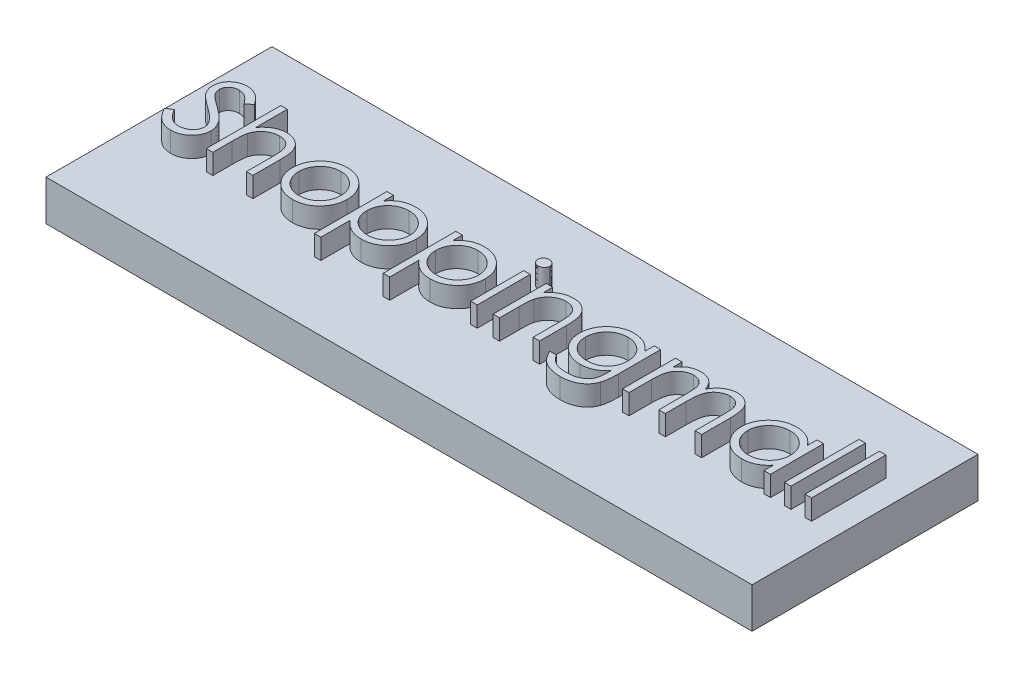
from build123d import *

# Parameters (mm, degrees)
SKETCH1_W              = 175
SKETCH1_H              = 56
BOSS_EXTRUDE1_DEPTH    = 10
BOSS_EXTRUDE2_DEPTH    = 5
BOSS_EXTRUDE2_2_DEPTH  = 5
BOSS_EXTRUDE2_3_DEPTH  = 5
BOSS_EXTRUDE2_4_DEPTH  = 5
BOSS_EXTRUDE2_5_DEPTH  = 5
BOSS_EXTRUDE2_6_DEPTH  = 5
SKETCH2_W              = 1.615384616
SKETCH2_H              = 13.153846154
BOSS_EXTRUDE2_7_DEPTH  = 5
BOSS_EXTRUDE2_8_DEPTH  = 5
BOSS_EXTRUDE2_9_DEPTH  = 5
BOSS_EXTRUDE2_10_DEPTH = 5
BOSS_EXTRUDE2_11_DEPTH = 5
SKETCH2_H_2            = 18.461538462
BOSS_EXTRUDE2_12_DEPTH = 5
BOSS_EXTRUDE2_13_DEPTH = 5


with BuildPart() as part:
    # Sketch1 → Boss-Extrude1 (new body)
    with BuildSketch(Plane(origin=(0, 0, 0), x_dir=(1, 0, 0), z_dir=(0, 1, 0))):
        Rectangle(SKETCH1_W, SKETCH1_H)
    extrude(amount=BOSS_EXTRUDE1_DEPTH)


with BuildPart() as body_2:
    # Sketch2 → Boss-Extrude2 (new body)
    with BuildSketch(Plane(origin=(0, 10, 0), x_dir=(1, 0, 0), z_dir=(0, 1, 0))):
        with BuildLine():
            Line((-82.615384615, -3.527644231), (-81.09375, -2.615384615))
            add(Edge.make_bspline(
                [(-81.09375, -2.615384615), (-80.952227637, -2.852287167), (-80.681076251, -3.306183312), (-80.228754975, -3.919510377), (-79.760071432, -4.440801469), (-79.27155486, -4.867024022), (-78.766187126, -5.202589726), (-78.240669136, -5.440201203), (-77.696771824, -5.588397648), (-77.326620742, -5.606398093), (-77.141826923, -5.615384615)],
                knots=[0, 0, 0, 0, 1.272034388, 2.437168799, 3.508375237, 4.49857839, 5.41946034, 6.295179144, 7.148887113, 8, 8, 8, 8], degree=3))
            add(Edge.make_bspline(
                [(-77.141826923, -5.615384615), (-76.984008783, -5.610989157), (-76.67113395, -5.60227515), (-76.21052813, -5.518545311), (-75.763193146, -5.389911505), (-75.338348724, -5.205689571), (-74.941856992, -4.98280593), (-74.594165416, -4.713597017), (-74.293585405, -4.412193674), (-74.047709959, -4.075940021), (-73.859069777, -3.714308971), (-73.714081997, -3.343118365), (-73.633621618, -2.956537156), (-73.621501172, -2.696254776), (-73.615384615, -2.564903846)],
                knots=[0, 0, 0, 0, 1.095163259, 2.171163733, 3.241058638, 4.321873601, 5.38011039, 6.391990106, 7.366004449, 8.327778327, 9.272591725, 10.192022065, 11.087607919, 12, 12, 12, 12], degree=3))
            add(Edge.make_bspline(
                [(-73.615384615, -2.564903846), (-73.622966785, -2.415036619), (-73.638380227, -2.110378446), (-73.76865641, -1.660894517), (-73.973595394, -1.216075585), (-74.162660419, -0.940926219), (-74.260817308, -0.798076923)],
                knots=[0, 0, 0, 0, 0.938893495, 1.908633276, 2.914225137, 4, 4, 4, 4], degree=3))
            add(Edge.make_bspline(
                [(-74.260817308, -0.798076923), (-74.341409038, -0.694978973), (-74.510601294, -0.478537723), (-74.801468502, -0.156362227), (-75.142779947, 0.175961071), (-75.522855372, 0.531121935), (-75.955539829, 0.892602032), (-76.427281332, 1.27763889), (-76.950124035, 1.671589858), (-77.31680716, 1.935791624), (-77.506009615, 2.072115385)],
                knots=[0, 0, 0, 0, 0.722233717, 1.516239348, 2.393582979, 3.351407094, 4.387010283, 5.505090956, 6.712668013, 8, 8, 8, 8], degree=3))
            add(Edge.make_bspline(
                [(-77.506009615, 2.072115385), (-77.695390167, 2.207005264), (-78.057471361, 2.464904441), (-78.563829784, 2.847657902), (-79.01662988, 3.197597802), (-79.413859108, 3.518018436), (-79.755342749, 3.80896326), (-80.04377172, 4.067638376), (-80.271798585, 4.301039546), (-80.398598714, 4.452452161), (-80.455528846, 4.520432692)],
                knots=[0, 0, 0, 0, 1.452282411, 2.77665338, 3.964542531, 5.026858415, 5.96415736, 6.766646006, 7.446254459, 8, 8, 8, 8], degree=3))
            add(Edge.make_bspline(
                [(-80.455528846, 4.520432692), (-80.535101936, 4.626380882), (-80.691593096, 4.834742216), (-80.898161124, 5.160412913), (-81.073733962, 5.493789706), (-81.211368813, 5.835768438), (-81.327269367, 6.181548072), (-81.405224439, 6.535640193), (-81.454037337, 6.896455945), (-81.459036125, 7.139268234), (-81.461538462, 7.260817308)],
                knots=[0, 0, 0, 0, 1.068054152, 2.10047183, 3.106115577, 4.101338837, 5.06977816, 6.043150881, 7.020423561, 8, 8, 8, 8], degree=3))
            add(Edge.make_bspline(
                [(-81.461538462, 7.260817308), (-81.454825958, 7.451256148), (-81.441544426, 7.828063333), (-81.329221766, 8.378507604), (-81.151932599, 8.90403775), (-80.90355889, 9.399450895), (-80.583378218, 9.851847368), (-80.212856064, 10.266431015), (-79.771539849, 10.614955152), (-79.287326358, 10.91947431), (-78.757322158, 11.157824782), (-78.20194037, 11.337624109), (-77.620298285, 11.439500291), (-77.226339307, 11.454120225), (-77.026442308, 11.461538462)],
                knots=[0, 0, 0, 0, 1.005424448, 1.989358655, 2.955360095, 3.929531133, 4.905563448, 5.876582895, 6.856512386, 7.866279853, 8.892233794, 9.918561126, 10.94386622, 12, 12, 12, 12], degree=3))
            add(Edge.make_bspline(
                [(-77.026442308, 11.461538462), (-76.814329792, 11.454222482), (-76.392505697, 11.439673333), (-75.772024017, 11.313171744), (-75.174626047, 11.103854003), (-74.694060685, 10.866312334), (-74.31794934, 10.629065053), (-74.031118144, 10.412963099), (-73.740456968, 10.164176826), (-73.443621258, 9.882043561), (-73.145640723, 9.563974555), (-72.842091541, 9.212148155), (-72.532263872, 8.828714439), (-72.33294802, 8.554988435), (-72.230769231, 8.414663462)],
                knots=[0, 0, 0, 0, 1.286793592, 2.559021753, 3.825965368, 5.121522368, 5.803751409, 6.523245864, 7.299691795, 8.125521123, 9.008227632, 9.944561021, 10.946284179, 12, 12, 12, 12], degree=3))
            Line((-72.230769231, 8.414663462), (-73.691105769, 7.307692308))
            add(Edge.make_bspline(
                [(-73.691105769, 7.307692308), (-73.779284851, 7.421291287), (-73.949097144, 7.640056361), (-74.206905934, 7.946423127), (-74.44989898, 8.226279307), (-74.689301036, 8.469357108), (-74.912468284, 8.68896808), (-75.129070215, 8.876989686), (-75.335989736, 9.035264177), (-75.596819562, 9.204173914), (-75.924510685, 9.371607361), (-76.335859728, 9.513288334), (-76.765732, 9.598428652), (-77.058512962, 9.609685788), (-77.206730769, 9.615384615)],
                knots=[0, 0, 0, 0, 1.181633172, 2.275549214, 3.290209073, 4.226197932, 5.078386478, 5.862611352, 6.581680152, 7.217281963, 8.414376989, 9.595101626, 10.782541182, 12, 12, 12, 12], degree=3))
            add(Edge.make_bspline(
                [(-77.206730769, 9.615384615), (-77.392678599, 9.609153016), (-77.751261471, 9.597135963), (-78.260354114, 9.465890324), (-78.718551443, 9.259240757), (-79.112250349, 8.969620869), (-79.440040517, 8.626484335), (-79.677154304, 8.231621652), (-79.819869436, 7.795597867), (-79.837284589, 7.491440778), (-79.846153846, 7.336538462)],
                knots=[0, 0, 0, 0, 1.14458467, 2.207223713, 3.21896685, 4.227309161, 5.202851033, 6.127160689, 7.046193047, 8, 8, 8, 8], degree=3))
            add(Edge.make_bspline(
                [(-79.846153846, 7.336538462), (-79.844132052, 7.240102286), (-79.840085158, 7.047072243), (-79.783643341, 6.761893502), (-79.711132506, 6.477435185), (-79.596227543, 6.194976187), (-79.437594553, 5.909576627), (-79.22928222, 5.616321976), (-78.966928044, 5.312627475), (-78.765960552, 5.115103838), (-78.659855769, 5.010817308)],
                knots=[0, 0, 0, 0, 0.858281714, 1.717966888, 2.583508476, 3.4729293, 4.427298488, 5.488583878, 6.674047936, 8, 8, 8, 8], degree=3))
            add(Edge.make_bspline(
                [(-78.659855769, 5.010817308), (-78.620454425, 4.975655461), (-78.526845852, 4.892118961), (-78.355712519, 4.75535866), (-78.129720985, 4.586658688), (-77.854772522, 4.377923918), (-77.525797519, 4.135790684), (-77.142759802, 3.863354965), (-76.709929061, 3.551772604), (-76.40278778, 3.333933824), (-76.240384615, 3.21875)],
                knots=[0, 0, 0, 0, 0.420754252, 0.999615792, 1.744751191, 2.668019286, 3.750313428, 4.999500688, 6.413464383, 8, 8, 8, 8], degree=3))
            add(Edge.make_bspline(
                [(-76.240384615, 3.21875), (-76.04502849, 3.076594437), (-75.666748428, 2.80132989), (-75.128509446, 2.387763536), (-74.640484147, 1.983289298), (-74.2009591, 1.590490175), (-73.805592143, 1.212345697), (-73.458769579, 0.844306484), (-73.156957509, 0.489009253), (-72.832035814, 0.03349315), (-72.500024171, -0.525952427), (-72.214896418, -1.211383368), (-72.035110631, -1.89947873), (-72.01159998, -2.361959604), (-72, -2.590144231)],
                knots=[0, 0, 0, 0, 1.163667725, 2.253281268, 3.268753668, 4.215851969, 5.092017293, 5.902905408, 6.650798638, 7.335211899, 8.59617414, 9.77448103, 10.901945474, 12, 12, 12, 12], degree=3))
            add(Edge.make_bspline(
                [(-72, -2.590144231), (-72.003379567, -2.75151868), (-72.010073074, -3.071133795), (-72.087014916, -3.540445619), (-72.199744622, -3.99626152), (-72.369650397, -4.432947242), (-72.577026639, -4.858491735), (-72.840167343, -5.261732366), (-73.145178293, -5.651593844), (-73.495066227, -6.017680371), (-73.877930867, -6.353746522), (-74.282589868, -6.652695981), (-74.709705558, -6.901961644), (-75.156960901, -7.105365975), (-75.624458632, -7.264452637), (-76.112041521, -7.379718821), (-76.620513293, -7.450462477), (-76.966115769, -7.45780525), (-77.141826923, -7.461538462)],
                knots=[0, 0, 0, 0, 0.983748083, 1.948392443, 2.894712957, 3.844097841, 4.80183111, 5.778335162, 6.776009319, 7.81870978, 8.863265674, 9.881300176, 10.883814829, 11.87499822, 12.874611388, 13.892143829, 14.928324115, 16, 16, 16, 16], degree=3))
            add(Edge.make_bspline(
                [(-77.141826923, -7.461538462), (-77.277780116, -7.458909528), (-77.54797431, -7.453684768), (-77.947623074, -7.407495326), (-78.339198104, -7.342144508), (-78.71778584, -7.238392148), (-79.088263957, -7.112510552), (-79.449021164, -6.957513413), (-79.800232298, -6.771767805), (-80.143865581, -6.559393393), (-80.47904705, -6.312239278), (-80.802632885, -6.024375582), (-81.125240125, -5.703741556), (-81.437346735, -5.341630088), (-81.745265763, -4.943891376), (-82.042926155, -4.506804147), (-82.336489274, -4.032749185), (-82.520683109, -3.699157315), (-82.615384615, -3.527644231)],
                knots=[0, 0, 0, 0, 0.915332311, 1.819136955, 2.706846663, 3.586547465, 4.459518054, 5.340707479, 6.227863349, 7.133153174, 8.059268498, 9.028702269, 10.047606654, 11.120612155, 12.245963614, 13.433783089, 14.680604001, 16, 16, 16, 16], degree=3))
        make_face()
    extrude(amount=BOSS_EXTRUDE2_DEPTH)


with BuildPart() as body_3:
    # Sketch2 → Boss-Extrude2 2 (new body)
    with BuildSketch(Plane(origin=(0, 10, 0), x_dir=(1, 0, 0), z_dir=(0, 1, 0))):
        with BuildLine():
            Line((-68.769230769, 11.461538462), (-67.153846154, 11.461538462))
            Line((-67.153846154, 11.461538462), (-67.153846154, 3.669471154))
            add(Edge.make_bspline(
                [(-67.153846154, 3.669471154), (-66.980442888, 3.886211633), (-66.642817845, 4.308216453), (-66.074552102, 4.858816863), (-65.490987617, 5.336066915), (-64.871968595, 5.715972123), (-64.228851633, 6.016091489), (-63.558924319, 6.228942242), (-62.862062181, 6.359833596), (-62.388789981, 6.376282602), (-62.149038462, 6.384615385)],
                knots=[0, 0, 0, 0, 1.125788106, 2.19196713, 3.20547328, 4.180437432, 5.132270164, 6.079753143, 7.027236121, 8, 8, 8, 8], degree=3))
            add(Edge.make_bspline(
                [(-62.149038462, 6.384615385), (-61.905625013, 6.375638886), (-61.429206179, 6.358069713), (-60.735530085, 6.219143754), (-60.0877313, 5.981762644), (-59.487735537, 5.656903658), (-58.948637094, 5.252300546), (-58.471124021, 4.785167001), (-58.081085628, 4.243758279), (-57.81571874, 3.743583259), (-57.6430555, 3.29852681), (-57.533760393, 2.916739032), (-57.44109023, 2.49131205), (-57.360348732, 2.022464855), (-57.306536027, 1.507946831), (-57.263312277, 0.950079237), (-57.232576227, 0.348894058), (-57.231385118, -0.067267225), (-57.230769231, -0.282451923)],
                knots=[0, 0, 0, 0, 1.235656852, 2.418478516, 3.575258207, 4.727955599, 5.870717718, 6.98870536, 8.107142894, 9.245821548, 9.854588956, 10.528768408, 11.260415777, 12.065282286, 12.943670737, 13.886611085, 14.907229059, 16, 16, 16, 16], degree=3))
            Line((-57.230769231, -0.282451923), (-57.230769231, -7))
            Line((-57.230769231, -7), (-58.846153846, -7))
            Line((-58.846153846, -7), (-58.846153846, -0.8125))
            add(Edge.make_bspline(
                [(-58.846153846, -0.8125), (-58.847132548, -0.633411985), (-58.849004638, -0.290847092), (-58.855193268, 0.19960718), (-58.869008089, 0.644444443), (-58.891332337, 1.042239052), (-58.91481106, 1.393545584), (-58.947125263, 1.697853864), (-58.984720752, 1.955581851), (-59.018503057, 2.110714227), (-59.033653846, 2.180288462)],
                knots=[0, 0, 0, 0, 1.430932559, 2.737130458, 3.918967929, 4.986496826, 5.920444988, 6.731744033, 7.431208747, 8, 8, 8, 8], degree=3))
            add(Edge.make_bspline(
                [(-59.033653846, 2.180288462), (-59.092407107, 2.384430389), (-59.205359908, 2.776892055), (-59.467892362, 3.310013021), (-59.795795847, 3.764563117), (-60.196153193, 4.134408027), (-60.661881922, 4.424524515), (-61.196018881, 4.625444538), (-61.793536947, 4.750147108), (-62.214487373, 4.762692097), (-62.433894231, 4.769230769)],
                knots=[0, 0, 0, 0, 1.090059168, 2.095632401, 3.037101401, 3.955032261, 4.878929692, 5.839099886, 6.873700383, 8, 8, 8, 8], degree=3))
            add(Edge.make_bspline(
                [(-62.433894231, 4.769230769), (-62.563842779, 4.766783662), (-62.821007597, 4.761940901), (-63.202343593, 4.713320852), (-63.572264491, 4.633870299), (-63.934332834, 4.526361243), (-64.280874994, 4.380069912), (-64.621992094, 4.210714653), (-64.948019454, 4.003415056), (-65.264746512, 3.770825395), (-65.559522398, 3.513323773), (-65.833776134, 3.241539433), (-66.078259027, 2.952125331), (-66.299754637, 2.649724735), (-66.490957249, 2.330189797), (-66.657858814, 1.996601873), (-66.799470967, 1.648522267), (-66.869839099, 1.406936236), (-66.905048077, 1.286057692)],
                knots=[0, 0, 0, 0, 1.024319606, 2.027102035, 3.025350316, 4.005802111, 5.00026367, 5.987881639, 7.005602596, 8.042517216, 9.083927026, 10.089214625, 11.084353441, 12.06828073, 13.041928858, 14.016821737, 15.00770877, 16, 16, 16, 16], degree=3))
            add(Edge.make_bspline(
                [(-66.905048077, 1.286057692), (-66.925307988, 1.198521373), (-66.969456829, 1.00776896), (-67.017361686, 0.693158151), (-67.060241783, 0.327571095), (-67.096491468, -0.088437706), (-67.118724483, -0.556392667), (-67.14268115, -1.073100456), (-67.151598936, -1.641797706), (-67.153074694, -2.037260316), (-67.153846154, -2.243990385)],
                knots=[0, 0, 0, 0, 0.607992626, 1.324890765, 2.152360218, 3.099583803, 4.150613268, 5.323148443, 6.60066238, 8, 8, 8, 8], degree=3))
            Line((-67.153846154, -2.243990385), (-67.153846154, -7))
            Line((-67.153846154, -7), (-68.769230769, -7))
            Line((-68.769230769, -7), (-68.769230769, 11.461538462))
        make_face()
    extrude(amount=BOSS_EXTRUDE2_2_DEPTH)


with BuildPart() as body_4:
    # Sketch2 → Boss-Extrude2 3 (new body)
    with BuildSketch(Plane(origin=(0, 10, 0), x_dir=(1, 0, 0), z_dir=(0, 1, 0))):
        with BuildLine():
            add(Edge.make_bspline(
                [(-47.185096154, 6.384615385), (-46.938283894, 6.379359944), (-46.454345369, 6.369055311), (-45.745619099, 6.258921202), (-45.069101257, 6.090506185), (-44.42220084, 5.857681008), (-43.813202749, 5.545602406), (-43.233236351, 5.173211766), (-42.683891734, 4.732044141), (-42.35463044, 4.390774076), (-42.1875, 4.217548077)],
                knots=[0, 0, 0, 0, 1.054011418, 2.066658804, 3.057071809, 4.030435133, 4.997543892, 5.974964718, 6.972108034, 8, 8, 8, 8], degree=3))
            add(Edge.make_bspline(
                [(-42.1875, 4.217548077), (-42.043592808, 4.05187615), (-41.758563424, 3.723738504), (-41.393082584, 3.191681066), (-41.078228846, 2.640674835), (-40.825905047, 2.063402869), (-40.626953496, 1.46490456), (-40.485701344, 0.843122788), (-40.401682822, 0.199430717), (-40.390353277, -0.237731879), (-40.384615385, -0.459134615)],
                knots=[0, 0, 0, 0, 1.025258237, 2.030674902, 3.01204498, 3.988269485, 4.97094183, 5.956517959, 6.965070386, 8, 8, 8, 8], degree=3))
            add(Edge.make_bspline(
                [(-40.384615385, -0.459134615), (-40.389662262, -0.681820626), (-40.399635128, -1.121858569), (-40.493973726, -1.769958165), (-40.640705025, -2.398388681), (-40.850697336, -3.004519106), (-41.119967612, -3.590202219), (-41.448548291, -4.152879901), (-41.838745179, -4.6936623), (-42.281051448, -5.207957469), (-42.769889668, -5.681955145), (-43.300201288, -6.095071959), (-43.86156489, -6.449011228), (-44.461444993, -6.734112794), (-45.094363497, -6.958905538), (-45.761685561, -7.116791337), (-46.462374494, -7.212251425), (-46.940800204, -7.224509802), (-47.185096154, -7.230769231)],
                knots=[0, 0, 0, 0, 0.998656419, 1.973391657, 2.932242238, 3.890759089, 4.846373663, 5.82037756, 6.809684879, 7.83454468, 8.860553229, 9.859544525, 10.845671541, 11.83227036, 12.833544569, 13.85385346, 14.904124723, 16, 16, 16, 16], degree=3))
            add(Edge.make_bspline(
                [(-47.185096154, -7.230769231), (-47.430588997, -7.224488793), (-47.911399133, -7.212188239), (-48.614561326, -7.117162213), (-49.283079366, -6.958978303), (-49.916826444, -6.733374054), (-50.519285657, -6.449002115), (-51.083901927, -6.096141997), (-51.614644349, -5.681832628), (-52.103585984, -5.207990666), (-52.545864525, -4.693653747), (-52.936068568, -4.152882121), (-53.264647388, -3.59020164), (-53.533918151, -3.004519261), (-53.743910332, -2.39838864), (-53.890641666, -1.769958176), (-53.984980255, -1.121858566), (-53.994953122, -0.681820625), (-54, -0.459134615)],
                knots=[0, 0, 0, 0, 1.099876186, 2.154163076, 3.173186993, 4.173200201, 5.163417411, 6.152872554, 7.150605724, 8.17532212, 9.198891216, 10.186952605, 11.159729845, 12.11414092, 13.071450619, 14.029093627, 15.002601286, 16, 16, 16, 16], degree=3))
            add(Edge.make_bspline(
                [(-54, -0.459134615), (-53.994222975, -0.238935237), (-53.982785459, 0.19702169), (-53.898851413, 0.839503716), (-53.758150265, 1.460233146), (-53.558960226, 2.056421308), (-53.304310673, 2.631163551), (-52.993881192, 3.183531253), (-52.624672225, 3.713182798), (-52.340776474, 4.040896353), (-52.197115385, 4.206730769)],
                knots=[0, 0, 0, 0, 1.031353054, 2.041901799, 3.029428768, 4.008703097, 4.981709435, 5.96992636, 6.972712378, 8, 8, 8, 8], degree=3))
            add(Edge.make_bspline(
                [(-52.197115385, 4.206730769), (-52.030236916, 4.381459028), (-51.702041045, 4.725092894), (-51.149961874, 5.164974447), (-50.571422223, 5.545114255), (-49.955694031, 5.850991935), (-49.309325047, 6.09187574), (-48.629340371, 6.259355532), (-47.918209149, 6.368658501), (-47.431902526, 6.379243415), (-47.185096154, 6.384615385)],
                knots=[0, 0, 0, 0, 1.027980169, 2.021703884, 2.998553061, 3.971491411, 4.943284454, 5.930300938, 6.949603206, 8, 8, 8, 8], degree=3))
        make_face()
        with BuildLine():
            add(Edge.make_bspline(
                [(-47.192307692, 4.769230769), (-47.366843979, 4.764270012), (-47.711410927, 4.754476559), (-48.218597362, 4.679987906), (-48.706861011, 4.561972171), (-49.177128209, 4.394294167), (-49.627813096, 4.177785544), (-50.059347166, 3.911856835), (-50.472999714, 3.600030201), (-50.860678897, 3.242793604), (-51.216473645, 2.852558775), (-51.527503239, 2.436767215), (-51.791975214, 2.002163149), (-52.012296032, 1.548294634), (-52.176390142, 1.07056222), (-52.295565686, 0.574376117), (-52.369984066, 0.058725403), (-52.379685441, -0.291816977), (-52.384615385, -0.469951923)],
                knots=[0, 0, 0, 0, 1.021534396, 2.016698045, 2.994645724, 3.958388632, 4.93408049, 5.916473867, 6.921342795, 7.962252576, 8.998418191, 10.008913653, 10.997312074, 11.973003931, 12.956656626, 13.948281152, 14.957379055, 16, 16, 16, 16], degree=3))
            add(Edge.make_bspline(
                [(-52.384615385, -0.469951923), (-52.37635172, -0.700105206), (-52.359949892, -1.156916434), (-52.226568676, -1.82965935), (-52.003439236, -2.475508876), (-51.702133226, -3.090678861), (-51.32461553, -3.659850577), (-50.879824902, -4.167303925), (-50.372535014, -4.605402384), (-49.808793013, -4.968903875), (-49.200113664, -5.257725476), (-48.555938298, -5.462405922), (-47.884071872, -5.59546034), (-47.424913826, -5.608685066), (-47.192307692, -5.615384615)],
                knots=[0, 0, 0, 0, 1.016792936, 2.018143844, 3.017858371, 4.030088057, 5.03801393, 6.028138512, 7.003788237, 7.991172063, 8.984598303, 9.972568034, 10.972917682, 12, 12, 12, 12], degree=3))
            add(Edge.make_bspline(
                [(-47.192307692, -5.615384615), (-46.959714938, -5.608646031), (-46.500583301, -5.595344253), (-45.829650392, -5.463076037), (-45.187235679, -5.256828639), (-44.579188544, -4.969228703), (-44.015703155, -4.604021998), (-43.504764816, -4.169777773), (-43.063771959, -3.658506538), (-42.686627705, -3.089924961), (-42.380387314, -2.476462579), (-42.158302276, -1.82954015), (-42.024600406, -1.156946791), (-42.008241858, -0.700115376), (-42, -0.469951923)],
                knots=[0, 0, 0, 0, 1.02726834, 2.027799167, 3.010890988, 4.004497153, 4.992059811, 5.971914811, 6.958719428, 7.966827853, 8.981595046, 9.981490638, 10.983022906, 12, 12, 12, 12], degree=3))
            add(Edge.make_bspline(
                [(-42, -0.469951923), (-42.004928246, -0.291815912), (-42.014626281, 0.058728563), (-42.089068955, 0.574364038), (-42.208154588, 1.070606535), (-42.372580048, 1.548131124), (-42.591943548, 2.003338289), (-42.861515626, 2.435491171), (-43.171275186, 2.853999122), (-43.531363236, 3.241532132), (-43.918637751, 3.600169463), (-44.332457947, 3.911977751), (-44.763352123, 4.176616814), (-45.212727691, 4.396146051), (-45.683055182, 4.560446658), (-46.170634703, 4.680669334), (-46.675657154, 4.754161774), (-47.018989376, 4.764175645), (-47.192307692, 4.769230769)],
                knots=[0, 0, 0, 0, 1.042956736, 2.052379634, 3.044323526, 4.02829302, 5.004299113, 5.996692471, 7.007513377, 8.048758398, 9.090003419, 10.095195979, 11.07790575, 12.047570684, 13.018257071, 13.989683339, 14.985167495, 16, 16, 16, 16], degree=3))
        make_face(mode=Mode.SUBTRACT)
    extrude(amount=BOSS_EXTRUDE2_3_DEPTH)


with BuildPart() as body_5:
    # Sketch2 → Boss-Extrude2 4 (new body)
    with BuildSketch(Plane(origin=(0, 10, 0), x_dir=(1, 0, 0), z_dir=(0, 1, 0))):
        with BuildLine():
            Line((-37.153846154, 6.153846154), (-35.538461538, 6.153846154))
            Line((-35.538461538, 6.153846154), (-35.538461538, 3.719951923))
            add(Edge.make_bspline(
                [(-35.538461538, 3.719951923), (-35.366908763, 3.940774554), (-35.033530276, 4.369899146), (-34.458945051, 4.92527695), (-33.85246432, 5.393664226), (-33.198481055, 5.760774396), (-32.507159221, 6.037567143), (-31.781335874, 6.242147171), (-31.014850798, 6.362703326), (-30.490811898, 6.377214726), (-30.223557692, 6.384615385)],
                knots=[0, 0, 0, 0, 1.0828784, 2.104357462, 3.088488658, 4.04616522, 5.001424249, 5.969181776, 6.964304535, 8, 8, 8, 8], degree=3))
            add(Edge.make_bspline(
                [(-30.223557692, 6.384615385), (-29.990115162, 6.377861893), (-29.528703736, 6.364513263), (-28.849521416, 6.274137553), (-28.195476586, 6.119246564), (-27.570269452, 5.896041856), (-26.967202259, 5.620099439), (-26.395202889, 5.271840399), (-25.845361745, 4.868608561), (-25.331507059, 4.404557499), (-24.856711454, 3.902469272), (-24.446073951, 3.362354565), (-24.091875586, 2.801975549), (-23.805571204, 2.212644789), (-23.581299703, 1.599003036), (-23.421795647, 0.958571054), (-23.326870623, 0.29372336), (-23.314134586, -0.158347774), (-23.307692308, -0.387019231)],
                knots=[0, 0, 0, 0, 1.041296284, 2.058176809, 3.050446431, 4.034000596, 5.01514041, 6.003636468, 7.015969324, 8.052561599, 9.08815499, 10.094063707, 11.074456064, 12.040834395, 13.011057502, 13.983766392, 14.980127149, 16, 16, 16, 16], degree=3))
            add(Edge.make_bspline(
                [(-23.307692308, -0.387019231), (-23.313994805, -0.620516818), (-23.326424239, -1.081007755), (-23.422827126, -1.757227112), (-23.576891051, -2.407733606), (-23.798333135, -3.031445247), (-24.084489361, -3.627932597), (-24.432684243, -4.196765491), (-24.843528931, -4.737761679), (-25.313077588, -5.243576593), (-25.822492687, -5.709515917), (-26.367005491, -6.117025989), (-26.938165679, -6.459238776), (-27.53305111, -6.745093997), (-28.156754394, -6.960539515), (-28.806365536, -7.115945347), (-29.481530861, -7.211779896), (-29.940793928, -7.224390915), (-30.173076923, -7.230769231)],
                knots=[0, 0, 0, 0, 1.038740735, 2.04854663, 3.033179607, 4.009277356, 4.987731542, 5.972001279, 6.972200261, 8.005528982, 9.039189865, 10.040446548, 11.026516639, 11.997840187, 12.972163198, 13.956796175, 14.96660207, 16, 16, 16, 16], degree=3))
            add(Edge.make_bspline(
                [(-30.173076923, -7.230769231), (-30.434475865, -7.22411022), (-30.95081541, -7.21095672), (-31.705774858, -7.077656897), (-32.432341525, -6.878438371), (-33.122465766, -6.586843547), (-33.781614516, -6.215243751), (-34.406059232, -5.762105549), (-34.999116818, -5.228376621), (-35.356076141, -4.823470138), (-35.538461538, -4.616586538)],
                knots=[0, 0, 0, 0, 1.014726462, 2.004382257, 2.969841629, 3.936926163, 4.907207904, 5.903978561, 6.929055279, 8, 8, 8, 8], degree=3))
            Line((-35.538461538, -4.616586538), (-35.538461538, -11.846153846))
            Line((-35.538461538, -11.846153846), (-37.153846154, -11.846153846))
            Line((-37.153846154, -11.846153846), (-37.153846154, 6.153846154))
        make_face()
        with BuildLine():
            add(Edge.make_bspline(
                [(-30.237980769, 4.769230769), (-30.420961376, 4.765938013), (-30.781203028, 4.759455424), (-31.309231582, 4.682446544), (-31.817836639, 4.570652447), (-32.30189239, 4.401391246), (-32.766038417, 4.193625921), (-33.206699836, 3.934004149), (-33.623567326, 3.627222404), (-34.015592054, 3.279157207), (-34.369746135, 2.89563024), (-34.683269764, 2.486321507), (-34.946621619, 2.05174936), (-35.165203437, 1.595961782), (-35.33154032, 1.11538603), (-35.449598307, 0.612759107), (-35.52381155, 0.087530872), (-35.533526085, -0.270185733), (-35.538461538, -0.451923077)],
                knots=[0, 0, 0, 0, 1.05670511, 2.080379991, 3.077984906, 4.06214886, 5.038337365, 6.01289324, 7.01187578, 8.025460281, 9.038092164, 10.024533457, 11.000252242, 11.969694649, 12.940728589, 13.933144304, 14.949937299, 16, 16, 16, 16], degree=3))
            add(Edge.make_bspline(
                [(-35.538461538, -0.451923077), (-35.530279993, -0.690490513), (-35.514251652, -1.157864325), (-35.383945188, -1.840754095), (-35.171878116, -2.486962609), (-34.870873303, -3.091047942), (-34.490571492, -3.646388237), (-34.032352402, -4.143654213), (-33.50036214, -4.57972011), (-32.903445154, -4.947029414), (-32.26355991, -5.245253756), (-31.596089506, -5.458755409), (-30.910212975, -5.590269727), (-30.446490188, -5.606967653), (-30.212740385, -5.615384615)],
                knots=[0, 0, 0, 0, 1.03728447, 2.032128127, 3.01272805, 3.987917167, 4.958271349, 5.931593992, 6.91984656, 7.941419022, 8.973179163, 9.983609215, 10.983593296, 12, 12, 12, 12], degree=3))
            add(Edge.make_bspline(
                [(-30.212740385, -5.615384615), (-29.983699292, -5.607380391), (-29.5290939, -5.591493446), (-28.859709275, -5.453982767), (-28.209185992, -5.24392264), (-27.591116533, -4.93761635), (-27.010881453, -4.562238909), (-26.486919178, -4.111930167), (-26.029169337, -3.589981888), (-25.639009797, -3.008795301), (-25.324619301, -2.385607614), (-25.088406638, -1.740789044), (-24.952076833, -1.076612583), (-24.932756206, -0.629195773), (-24.923076923, -0.405048077)],
                knots=[0, 0, 0, 0, 1.00104056, 1.986885549, 2.97790532, 3.984399681, 4.995088187, 5.994304198, 6.996462723, 8.023150851, 9.048424203, 10.043036403, 11.019596776, 12, 12, 12, 12], degree=3))
            add(Edge.make_bspline(
                [(-24.923076923, -0.405048077), (-24.930558411, -0.179508133), (-24.9454631, 0.269814572), (-25.092276436, 0.932023787), (-25.312904893, 1.579447664), (-25.63463716, 2.194124777), (-26.016243689, 2.774105774), (-26.477799673, 3.286097151), (-26.995254398, 3.734403468), (-27.57479867, 4.104768433), (-28.196778001, 4.39937955), (-28.851540425, 4.614781122), (-29.535764666, 4.744246119), (-30.001849747, 4.760829294), (-30.237980769, 4.769230769)],
                knots=[0, 0, 0, 0, 0.983928682, 1.960191568, 2.949917689, 3.96440592, 4.982380491, 5.975291189, 6.965713506, 7.964880129, 8.970154049, 9.96478489, 10.968906225, 12, 12, 12, 12], degree=3))
        make_face(mode=Mode.SUBTRACT)
    extrude(amount=BOSS_EXTRUDE2_4_DEPTH)


with BuildPart() as body_6:
    # Sketch2 → Boss-Extrude2 5 (new body)
    with BuildSketch(Plane(origin=(0, 10, 0), x_dir=(1, 0, 0), z_dir=(0, 1, 0))):
        with BuildLine():
            Line((-20.076923077, 6.153846154), (-18.461538462, 6.153846154))
            Line((-18.461538462, 6.153846154), (-18.461538462, 3.719951923))
            add(Edge.make_bspline(
                [(-18.461538462, 3.719951923), (-18.289985686, 3.940774554), (-17.956607199, 4.369899146), (-17.382021974, 4.92527695), (-16.775541243, 5.393664226), (-16.121557979, 5.760774396), (-15.430236144, 6.037567143), (-14.704412797, 6.242147171), (-13.937927721, 6.362703326), (-13.413888821, 6.377214726), (-13.146634615, 6.384615385)],
                knots=[0, 0, 0, 0, 1.0828784, 2.104357462, 3.088488658, 4.04616522, 5.001424249, 5.969181776, 6.964304535, 8, 8, 8, 8], degree=3))
            add(Edge.make_bspline(
                [(-13.146634615, 6.384615385), (-12.913192085, 6.377861893), (-12.451780659, 6.364513263), (-11.772598339, 6.274137553), (-11.118553509, 6.119246564), (-10.493346375, 5.896041856), (-9.890279182, 5.620099439), (-9.318279812, 5.271840399), (-8.768438668, 4.868608561), (-8.254583982, 4.404557499), (-7.779788377, 3.902469272), (-7.369150874, 3.362354565), (-7.014952509, 2.801975549), (-6.728648127, 2.212644789), (-6.504376626, 1.599003036), (-6.34487257, 0.958571054), (-6.249947546, 0.29372336), (-6.237211509, -0.158347774), (-6.230769231, -0.387019231)],
                knots=[0, 0, 0, 0, 1.041296284, 2.058176809, 3.050446431, 4.034000596, 5.01514041, 6.003636468, 7.015969324, 8.052561599, 9.08815499, 10.094063707, 11.074456064, 12.040834395, 13.011057502, 13.983766392, 14.980127149, 16, 16, 16, 16], degree=3))
            add(Edge.make_bspline(
                [(-6.230769231, -0.387019231), (-6.237071728, -0.620516818), (-6.249501162, -1.081007755), (-6.34590405, -1.757227112), (-6.499967974, -2.407733606), (-6.721410058, -3.031445247), (-7.007566284, -3.627932597), (-7.355761166, -4.196765491), (-7.766605854, -4.737761679), (-8.236154511, -5.243576593), (-8.74556961, -5.709515917), (-9.290082414, -6.117025989), (-9.861242602, -6.459238776), (-10.456128033, -6.745093997), (-11.079831317, -6.960539515), (-11.729442459, -7.115945347), (-12.404607784, -7.211779896), (-12.863870852, -7.224390915), (-13.096153846, -7.230769231)],
                knots=[0, 0, 0, 0, 1.038740735, 2.04854663, 3.033179607, 4.009277356, 4.987731542, 5.972001279, 6.972200261, 8.005528982, 9.039189865, 10.040446548, 11.026516639, 11.997840187, 12.972163198, 13.956796175, 14.96660207, 16, 16, 16, 16], degree=3))
            add(Edge.make_bspline(
                [(-13.096153846, -7.230769231), (-13.357552788, -7.22411022), (-13.873892333, -7.21095672), (-14.628851781, -7.077656897), (-15.355418448, -6.878438371), (-16.045542689, -6.586843547), (-16.704691439, -6.215243751), (-17.329136155, -5.762105549), (-17.922193741, -5.228376621), (-18.279153064, -4.823470138), (-18.461538462, -4.616586538)],
                knots=[0, 0, 0, 0, 1.014726462, 2.004382257, 2.969841629, 3.936926163, 4.907207904, 5.903978561, 6.929055279, 8, 8, 8, 8], degree=3))
            Line((-18.461538462, -4.616586538), (-18.461538462, -11.846153846))
            Line((-18.461538462, -11.846153846), (-20.076923077, -11.846153846))
            Line((-20.076923077, -11.846153846), (-20.076923077, 6.153846154))
        make_face()
        with BuildLine():
            add(Edge.make_bspline(
                [(-13.161057692, 4.769230769), (-13.344038299, 4.765938013), (-13.704279951, 4.759455424), (-14.232308505, 4.682446544), (-14.740913563, 4.570652447), (-15.224969313, 4.401391246), (-15.68911534, 4.193625921), (-16.129776759, 3.934004149), (-16.546644249, 3.627222404), (-16.938668977, 3.279157207), (-17.292823058, 2.89563024), (-17.606346687, 2.486321507), (-17.869698542, 2.05174936), (-18.088280361, 1.595961782), (-18.254617243, 1.11538603), (-18.37267523, 0.612759107), (-18.446888473, 0.087530872), (-18.456603008, -0.270185733), (-18.461538462, -0.451923077)],
                knots=[0, 0, 0, 0, 1.05670511, 2.080379991, 3.077984906, 4.06214886, 5.038337365, 6.01289324, 7.01187578, 8.025460281, 9.038092164, 10.024533457, 11.000252242, 11.969694649, 12.940728589, 13.933144304, 14.949937299, 16, 16, 16, 16], degree=3))
            add(Edge.make_bspline(
                [(-18.461538462, -0.451923077), (-18.453356916, -0.690490513), (-18.437328575, -1.157864325), (-18.307022111, -1.840754095), (-18.094955039, -2.486962609), (-17.793950226, -3.091047942), (-17.413648415, -3.646388237), (-16.955429325, -4.143654213), (-16.423439063, -4.57972011), (-15.826522077, -4.947029414), (-15.186636834, -5.245253756), (-14.519166429, -5.458755409), (-13.833289898, -5.590269727), (-13.369567111, -5.606967653), (-13.135817308, -5.615384615)],
                knots=[0, 0, 0, 0, 1.03728447, 2.032128127, 3.01272805, 3.987917167, 4.958271349, 5.931593992, 6.91984656, 7.941419022, 8.973179163, 9.983609215, 10.983593296, 12, 12, 12, 12], degree=3))
            add(Edge.make_bspline(
                [(-13.135817308, -5.615384615), (-12.906776215, -5.607380391), (-12.452170823, -5.591493446), (-11.782786198, -5.453982767), (-11.132262915, -5.24392264), (-10.514193457, -4.93761635), (-9.933958376, -4.562238909), (-9.409996101, -4.111930167), (-8.95224626, -3.589981888), (-8.56208672, -3.008795301), (-8.247696224, -2.385607614), (-8.011483561, -1.740789044), (-7.875153756, -1.076612583), (-7.855833129, -0.629195773), (-7.846153846, -0.405048077)],
                knots=[0, 0, 0, 0, 1.00104056, 1.986885549, 2.97790532, 3.984399681, 4.995088187, 5.994304198, 6.996462723, 8.023150851, 9.048424203, 10.043036403, 11.019596776, 12, 12, 12, 12], degree=3))
            add(Edge.make_bspline(
                [(-7.846153846, -0.405048077), (-7.853635334, -0.179508133), (-7.868540023, 0.269814572), (-8.01535336, 0.932023787), (-8.235981816, 1.579447664), (-8.557714084, 2.194124777), (-8.939320612, 2.774105774), (-9.400876596, 3.286097151), (-9.918331321, 3.734403468), (-10.497875593, 4.104768433), (-11.119854924, 4.39937955), (-11.774617348, 4.614781122), (-12.458841589, 4.744246119), (-12.92492667, 4.760829294), (-13.161057692, 4.769230769)],
                knots=[0, 0, 0, 0, 0.983928682, 1.960191568, 2.949917689, 3.96440592, 4.982380491, 5.975291189, 6.965713506, 7.964880129, 8.970154049, 9.96478489, 10.968906225, 12, 12, 12, 12], degree=3))
        make_face(mode=Mode.SUBTRACT)
    extrude(amount=BOSS_EXTRUDE2_5_DEPTH)


with BuildPart() as body_7:
    # Sketch2 → Boss-Extrude2 6 (new body)
    with BuildSketch(Plane(origin=(0, 10, 0), x_dir=(1, 0, 0), z_dir=(0, 1, 0))):
        with BuildLine():
            add(Edge.make_bspline(
                [(-2.430288462, 11.692307692), (-2.330047409, 11.687657766), (-2.133756175, 11.678552316), (-1.849905085, 11.600579006), (-1.591440451, 11.468409195), (-1.362183539, 11.291085122), (-1.16545955, 11.082545127), (-1.027730183, 10.839488718), (-0.939209288, 10.576901433), (-0.928519576, 10.393738117), (-0.923076923, 10.300480769)],
                knots=[0, 0, 0, 0, 1.055194115, 2.066272739, 3.074728998, 4.095836921, 5.109056067, 6.073838105, 7.019297344, 8, 8, 8, 8], degree=3))
            add(Edge.make_bspline(
                [(-0.923076923, 10.300480769), (-0.928642316, 10.209644267), (-0.939644441, 10.030071253), (-1.027661809, 9.772036254), (-1.166633318, 9.532357082), (-1.362057392, 9.324222), (-1.591473877, 9.146995955), (-1.849896205, 9.014800155), (-2.133758511, 8.936833734), (-2.330048199, 8.927727335), (-2.430288462, 8.923076923)],
                knots=[0, 0, 0, 0, 0.96129708, 1.900370562, 2.859976407, 3.87933698, 4.906634145, 5.921202961, 6.938410037, 8, 8, 8, 8], degree=3))
            add(Edge.make_bspline(
                [(-2.430288462, 8.923076923), (-2.529382448, 8.92754977), (-2.722255946, 8.936255582), (-3.00185685, 9.016329959), (-3.258117652, 9.147041192), (-3.487821683, 9.323061572), (-3.679291248, 9.53363533), (-3.818654064, 9.771889984), (-3.906468154, 10.030108493), (-3.917497672, 10.209656777), (-3.923076923, 10.300480769)],
                knots=[0, 0, 0, 0, 1.054934014, 2.053291228, 3.073705704, 4.106921865, 5.123545215, 6.088680038, 7.033164197, 8, 8, 8, 8], degree=3))
            add(Edge.make_bspline(
                [(-3.923076923, 10.300480769), (-3.917619906, 10.393725139), (-3.906901981, 10.576862963), (-3.818588241, 10.839637418), (-3.680452086, 11.081256571), (-3.487694902, 11.292244853), (-3.258151393, 11.468364232), (-3.001848132, 11.59904928), (-2.722258249, 11.679130454), (-2.52938323, 11.687835328), (-2.430288462, 11.692307692)],
                knots=[0, 0, 0, 0, 0.98631895, 1.937192651, 2.907499808, 3.917963147, 4.944918757, 5.95915025, 6.951458133, 8, 8, 8, 8], degree=3))
        make_face()
    extrude(amount=BOSS_EXTRUDE2_6_DEPTH)


with BuildPart() as body_8:
    # Sketch2 → Boss-Extrude2 7 (new body)
    with BuildSketch(Plane(origin=(0, 10, 0), x_dir=(1, 0, 0), z_dir=(0, 1, 0))):
        with Locations((-2.423076923, -0.423076923)):
            Rectangle(SKETCH2_W, SKETCH2_H)
    extrude(amount=BOSS_EXTRUDE2_7_DEPTH)


with BuildPart() as body_9:
    # Sketch2 → Boss-Extrude2 8 (new body)
    with BuildSketch(Plane(origin=(0, 10, 0), x_dir=(1, 0, 0), z_dir=(0, 1, 0))):
        with BuildLine():
            Line((2.307692308, 6.153846154), (3.923076923, 6.153846154))
            Line((3.923076923, 6.153846154), (3.923076923, 3.78125))
            add(Edge.make_bspline(
                [(3.923076923, 3.78125), (4.095556189, 3.996441146), (4.430258223, 4.414027073), (4.987663366, 4.962875742), (5.576746282, 5.415165471), (6.193899443, 5.775699268), (6.839960638, 6.047481917), (7.51099174, 6.243763848), (8.211010229, 6.361457252), (8.687055904, 6.376835579), (8.927884615, 6.384615385)],
                knots=[0, 0, 0, 0, 1.12780773, 2.188550248, 3.19190651, 4.159438251, 5.104880172, 6.052711206, 7.014878035, 8, 8, 8, 8], degree=3))
            add(Edge.make_bspline(
                [(8.927884615, 6.384615385), (9.171299305, 6.375640094), (9.647720568, 6.358073285), (10.341379169, 6.219130302), (10.989242337, 5.981811847), (11.589000052, 5.656721199), (12.129654292, 5.252459336), (12.604467814, 4.781487887), (12.997193087, 4.239759459), (13.260493811, 3.737183227), (13.433939999, 3.291355142), (13.543134877, 2.909514713), (13.635865639, 2.484107078), (13.716257486, 2.016417763), (13.770654061, 1.503169927), (13.813557275, 0.946467511), (13.844304846, 0.34649084), (13.845524767, -0.068468958), (13.846153846, -0.282451923)],
                knots=[0, 0, 0, 0, 1.235846778, 2.418850247, 3.575807741, 4.728682307, 5.871620074, 6.994088408, 8.11269785, 9.256955736, 9.865816715, 10.540099792, 11.271859618, 12.076849838, 12.949306005, 13.892391288, 14.913166135, 16, 16, 16, 16], degree=3))
            Line((13.846153846, -0.282451923), (13.846153846, -7))
            Line((13.846153846, -7), (12.230769231, -7))
            Line((12.230769231, -7), (12.230769231, -0.8125))
            add(Edge.make_bspline(
                [(12.230769231, -0.8125), (12.22977559, -0.63341314), (12.227874923, -0.290850456), (12.221880169, 0.199618806), (12.207429735, 0.644406923), (12.187124125, 1.042450527), (12.157403397, 1.393367401), (12.126429864, 1.697872253), (12.088552841, 1.955578471), (12.054800716, 2.11071318), (12.039663462, 2.180288462)],
                knots=[0, 0, 0, 0, 1.430800155, 2.736877192, 3.918605307, 4.986035426, 5.920637409, 6.731861385, 7.431261377, 8, 8, 8, 8], degree=3))
            add(Edge.make_bspline(
                [(12.039663462, 2.180288462), (11.985017871, 2.384517413), (11.879842016, 2.777594956), (11.61995296, 3.310777341), (11.291765744, 3.764368022), (10.891148233, 4.13556259), (10.42197013, 4.424441179), (9.885533396, 4.62487866), (9.287014672, 4.75024233), (8.866049276, 4.762724724), (8.646634615, 4.769230769)],
                knots=[0, 0, 0, 0, 1.084156227, 2.086665306, 3.027808233, 3.945421172, 4.874247719, 5.839848303, 6.874090471, 8, 8, 8, 8], degree=3))
            add(Edge.make_bspline(
                [(8.646634615, 4.769230769), (8.516686528, 4.766782745), (8.259522621, 4.761938169), (7.878179909, 4.713331493), (7.508284161, 4.633830865), (7.146123086, 4.526506443), (6.798940147, 4.379100487), (6.455580935, 4.211806583), (6.12897472, 4.003272922), (5.812157249, 3.770864011), (5.517405666, 3.513313803), (5.24314564, 3.241542036), (4.998664393, 2.952124645), (4.777168349, 2.649724915), (4.585965852, 2.330189748), (4.419064256, 1.996601887), (4.277452111, 1.648522264), (4.207083979, 1.406936235), (4.171875, 1.286057692)],
                knots=[0, 0, 0, 0, 1.023777757, 2.026029729, 3.023749952, 4.003683103, 4.997618607, 5.993177895, 7.010360494, 8.046726602, 9.087585522, 10.09234134, 11.086953743, 12.070360549, 13.043493632, 14.017870808, 15.008233677, 16, 16, 16, 16], degree=3))
            add(Edge.make_bspline(
                [(4.171875, 1.286057692), (4.15161395, 1.197316648), (4.107506705, 1.004132037), (4.059867494, 0.687103594), (4.016628535, 0.32036658), (3.980438462, -0.095651051), (3.95829632, -0.562405837), (3.934153708, -1.077904431), (3.925364251, -1.644202371), (3.923860716, -2.038462505), (3.923076923, -2.243990385)],
                knots=[0, 0, 0, 0, 0.615963638, 1.340920617, 2.168419149, 3.115676021, 4.16674242, 5.331190069, 6.6087489, 8, 8, 8, 8], degree=3))
            Line((3.923076923, -2.243990385), (3.923076923, -7))
            Line((3.923076923, -7), (2.307692308, -7))
            Line((2.307692308, -7), (2.307692308, 6.153846154))
        make_face()
    extrude(amount=BOSS_EXTRUDE2_8_DEPTH)


with BuildPart() as body_10:
    # Sketch2 → Boss-Extrude2 9 (new body)
    with BuildSketch(Plane(origin=(0, 10, 0), x_dir=(1, 0, 0), z_dir=(0, 1, 0))):
        with BuildLine():
            Line((29.076923077, 6.153846154), (30.692307692, 6.153846154))
            Line((30.692307692, 6.153846154), (30.692307692, -4.284855769))
            add(Edge.make_bspline(
                [(30.692307692, -4.284855769), (30.690882902, -4.507220541), (30.688132713, -4.936438115), (30.668327718, -5.557069268), (30.626564235, -6.130323422), (30.579205303, -6.658815037), (30.511079333, -7.140094461), (30.427886587, -7.575597799), (30.334103095, -7.965742977), (30.251713405, -8.206042159), (30.212740385, -8.319711538)],
                knots=[0, 0, 0, 0, 1.307562039, 2.523909702, 3.650326591, 4.686913197, 5.643429486, 6.506965704, 7.293745905, 8, 8, 8, 8], degree=3))
            add(Edge.make_bspline(
                [(30.212740385, -8.319711538), (30.155195728, -8.467465421), (30.041826964, -8.75855544), (29.829500849, -9.17118909), (29.591726487, -9.55971338), (29.320148913, -9.92196313), (29.015996206, -10.256119822), (28.686434246, -10.569443247), (28.325044691, -10.855304679), (27.932034171, -11.108771923), (27.516462343, -11.337048202), (27.078568104, -11.534773404), (26.620820706, -11.706991457), (26.138920121, -11.835988693), (25.640421772, -11.947767256), (25.119463555, -12.020511354), (24.579089172, -12.070021939), (24.211655788, -12.07460028), (24.025240385, -12.076923077)],
                knots=[0, 0, 0, 0, 0.981931301, 1.934503488, 2.87077864, 3.801706999, 4.735015492, 5.667491629, 6.616593066, 7.585388521, 8.561939025, 9.551802639, 10.560317337, 11.588439944, 12.640189604, 13.723962949, 14.845264515, 16, 16, 16, 16], degree=3))
            add(Edge.make_bspline(
                [(24.025240385, -12.076923077), (23.75326175, -12.072518293), (23.222014403, -12.063914566), (22.44747444, -11.963675574), (21.711867309, -11.82196737), (21.02491296, -11.607482313), (20.390952462, -11.345006366), (19.814315388, -11.043660894), (19.300178264, -10.698115877), (18.836685088, -10.304684215), (18.41835691, -9.836870995), (18.024787991, -9.285562654), (17.64596029, -8.64236151), (17.423950152, -8.170284699), (17.307692308, -7.923076923)],
                knots=[0, 0, 0, 0, 1.157897085, 2.2616841, 3.32207898, 4.345638746, 5.321241055, 6.241986252, 7.112515963, 7.955008012, 8.825025602, 9.77857164, 10.836726669, 12, 12, 12, 12], degree=3))
            Line((17.307692308, -7.923076923), (18.923076923, -7.923076923))
            add(Edge.make_bspline(
                [(18.923076923, -7.923076923), (19.052996857, -8.129335713), (19.306974328, -8.532546248), (19.781909373, -9.054613907), (20.302399052, -9.500774068), (20.886008851, -9.860315192), (21.535167102, -10.131394119), (22.250264345, -10.324638501), (23.037119542, -10.440333588), (23.584927501, -10.454277386), (23.870192308, -10.461538462)],
                knots=[0, 0, 0, 0, 0.997731894, 1.950442991, 2.880492273, 3.800895997, 4.748200782, 5.754801363, 6.83083817, 8, 8, 8, 8], degree=3))
            add(Edge.make_bspline(
                [(23.870192308, -10.461538462), (24.151850601, -10.454183411), (24.694859597, -10.440003609), (25.47570561, -10.324586867), (26.188479577, -10.131352065), (26.829074894, -9.86079465), (27.389933133, -9.529335416), (27.873423373, -9.159049319), (28.265024565, -8.741547018), (28.528405536, -8.356954873), (28.692126427, -8.014316491), (28.796383645, -7.719360283), (28.881106916, -7.385831198), (28.951974652, -7.014847412), (29.010453635, -6.60587889), (29.04749703, -6.15799053), (29.074269775, -5.672200244), (29.076018192, -5.33537839), (29.076923077, -5.161057692)],
                knots=[0, 0, 0, 0, 1.570740765, 3.028230971, 4.391408896, 5.680370741, 6.894727393, 8.017376726, 9.065722033, 10.075533815, 10.603371122, 11.180248986, 11.817768598, 12.521299649, 13.286540596, 14.121245857, 15.027658897, 16, 16, 16, 16], degree=3))
            Line((29.076923077, -5.161057692), (29.076923077, -4.479567308))
            add(Edge.make_bspline(
                [(29.076923077, -4.479567308), (28.912963045, -4.674696576), (28.587926987, -5.061522848), (28.026597876, -5.568411266), (27.413482309, -6.004968507), (26.749624091, -6.363007199), (26.05128456, -6.649368811), (25.326027375, -6.849646896), (24.580353949, -6.979040667), (24.075057178, -6.992964007), (23.819711538, -7)],
                knots=[0, 0, 0, 0, 1.012485704, 2.007162095, 2.997754123, 3.998611389, 4.999708251, 5.992315798, 6.98544096, 8, 8, 8, 8], degree=3))
            add(Edge.make_bspline(
                [(23.819711538, -7), (23.669353581, -6.997351292), (23.370417, -6.992085222), (22.926306871, -6.94601151), (22.488750331, -6.879160835), (22.058767855, -6.78102772), (21.635738988, -6.655070269), (21.2203628, -6.497612756), (20.809276092, -6.319592148), (20.409951246, -6.109903444), (20.026365431, -5.87661158), (19.661411907, -5.623897285), (19.317002278, -5.353083231), (18.996414617, -5.06149897), (18.70006945, -4.749566515), (18.423980986, -4.4206111), (18.172714629, -4.070039287), (17.941114342, -3.704243506), (17.74024694, -3.320787326), (17.563927313, -2.927985692), (17.410621802, -2.526678498), (17.288399736, -2.115522176), (17.195051153, -1.694775936), (17.125569986, -1.265129056), (17.086160623, -0.825258491), (17.080015299, -0.528920124), (17.076923077, -0.379807692)],
                knots=[0, 0, 0, 0, 1.028754217, 2.045334182, 3.052854819, 4.056607503, 5.061168794, 6.071104265, 7.095078842, 8.125279047, 9.155117945, 10.165957491, 11.161587969, 12.151493252, 13.128948131, 14.104219989, 15.088194871, 16.07871515, 17.064853787, 18.047899887, 19.02414258, 20.002704429, 20.980574569, 21.971845993, 22.979467364, 24, 24, 24, 24], degree=3))
            add(Edge.make_bspline(
                [(17.076923077, -0.379807692), (17.079593075, -0.230648913), (17.08492273, 0.067090932), (17.130956338, 0.508756343), (17.196621312, 0.944507724), (17.300546981, 1.369853596), (17.42563424, 1.789638033), (17.58055547, 2.200760381), (17.766823375, 2.603345856), (17.977730659, 2.997692589), (18.214734564, 3.378508895), (18.474615894, 3.740188788), (18.75768839, 4.080070815), (19.060046813, 4.401583842), (19.385383015, 4.701625807), (19.73352869, 4.979468483), (20.101052074, 5.23976919), (20.489092217, 5.476913209), (20.891661644, 5.686650477), (21.298532707, 5.878029547), (21.715095058, 6.029919305), (22.133582404, 6.163752386), (22.561364823, 6.258561961), (22.993197133, 6.331704919), (23.430557727, 6.376266342), (23.72345833, 6.381828779), (23.870192308, 6.384615385)],
                knots=[0, 0, 0, 0, 1.008818848, 2.013730394, 3.001654427, 3.987803273, 4.973046549, 5.963777569, 6.957074694, 7.972068341, 8.987420212, 9.989399531, 10.982630087, 11.977756091, 12.973280677, 13.973972381, 14.989194003, 16.018387222, 17.047741039, 18.059210846, 19.057554164, 20.045176975, 21.029480261, 22.018708529, 23.007435371, 24, 24, 24, 24], degree=3))
            add(Edge.make_bspline(
                [(23.870192308, 6.384615385), (24.112168565, 6.377638208), (24.589997323, 6.363860427), (25.293185335, 6.25575168), (25.971745427, 6.083393897), (26.62950665, 5.836456368), (27.271827141, 5.499341885), (27.89658994, 5.055292438), (28.50560263, 4.500324977), (28.881431473, 4.074738817), (29.076923077, 3.853365385)],
                knots=[0, 0, 0, 0, 0.96728863, 1.910097829, 2.838038873, 3.762875196, 4.71315279, 5.730631239, 6.819562287, 8, 8, 8, 8], degree=3))
            Line((29.076923077, 3.853365385), (29.076923077, 6.153846154))
        make_face()
        with BuildLine():
            add(Edge.make_bspline(
                [(24, 4.769230769), (23.763784951, 4.761202432), (23.296129243, 4.745308028), (22.610646339, 4.609615217), (21.948879253, 4.39697916), (21.323479908, 4.092817138), (20.737671914, 3.722046771), (20.217858551, 3.272868149), (19.763204697, 2.759887708), (19.378606729, 2.187743581), (19.072445416, 1.570486164), (18.85570783, 0.919859531), (18.715564853, 0.246376711), (18.700096928, -0.213253819), (18.692307692, -0.444711538)],
                knots=[0, 0, 0, 0, 1.026226791, 2.031711442, 3.026614839, 4.04107745, 5.047145931, 6.032893242, 7.017642609, 8.019221815, 9.021877557, 10.003543541, 10.994637589, 12, 12, 12, 12], degree=3))
            add(Edge.make_bspline(
                [(18.692307692, -0.444711538), (18.696040156, -0.619225512), (18.703380821, -0.962443464), (18.773959221, -1.466124065), (18.888032755, -1.945851392), (19.049709816, -2.401654461), (19.250037962, -2.836147692), (19.501998727, -3.246338042), (19.798489438, -3.632590816), (20.137189462, -3.992049179), (20.510439426, -4.319448445), (20.915281022, -4.607129797), (21.351165164, -4.842419219), (21.807371616, -5.045772098), (22.29496979, -5.194293019), (22.806936518, -5.307635311), (23.346893814, -5.37248035), (23.714977045, -5.380517596), (23.902644231, -5.384615385)],
                knots=[0, 0, 0, 0, 1.039728707, 2.044842319, 3.024901384, 3.974314358, 4.923051295, 5.871625912, 6.837440708, 7.820715446, 8.810779094, 9.792721783, 10.773906224, 11.758876063, 12.764959493, 13.806266761, 14.881525401, 16, 16, 16, 16], degree=3))
            add(Edge.make_bspline(
                [(23.902644231, -5.384615385), (24.092743559, -5.380667681), (24.46448078, -5.372947988), (25.007417024, -5.306587139), (25.521871118, -5.199502689), (26.007371347, -5.047464273), (26.465750815, -4.853466699), (26.891860262, -4.607964094), (27.29483628, -4.328375587), (27.661812101, -4.002256656), (27.993650667, -3.642848111), (28.282837468, -3.251760079), (28.529254634, -2.83487741), (28.733311222, -2.392247095), (28.889094558, -1.920429279), (28.993591783, -1.420603449), (29.066655044, -0.895164221), (29.073448371, -0.535119909), (29.076923077, -0.350961538)],
                knots=[0, 0, 0, 0, 1.121943988, 2.193949579, 3.223793937, 4.220241907, 5.192961521, 6.155822191, 7.11847367, 8.083710714, 9.04790392, 10.001595906, 10.949595423, 11.902125208, 12.873731292, 13.87582262, 14.913508608, 16, 16, 16, 16], degree=3))
            add(Edge.make_bspline(
                [(29.076923077, -0.350961538), (29.070033869, -0.111212575), (29.056574778, 0.35717265), (28.929560824, 1.0396646), (28.724771172, 1.681332065), (28.437559303, 2.280145655), (28.07765183, 2.829760482), (27.644156036, 3.319997397), (27.144547879, 3.751487516), (26.580262792, 4.11096394), (25.973161646, 4.401357603), (25.33790978, 4.619218145), (24.675450308, 4.74261748), (24.226445916, 4.760308617), (24, 4.769230769)],
                knots=[0, 0, 0, 0, 1.070913519, 2.092188694, 3.091357305, 4.074328408, 5.051968682, 6.018948707, 6.99050112, 7.9935919, 9.000589572, 9.992915277, 10.987769056, 12, 12, 12, 12], degree=3))
        make_face(mode=Mode.SUBTRACT)
    extrude(amount=BOSS_EXTRUDE2_9_DEPTH)


with BuildPart() as body_11:
    # Sketch2 → Boss-Extrude2 10 (new body)
    with BuildSketch(Plane(origin=(0, 10, 0), x_dir=(1, 0, 0), z_dir=(0, 1, 0))):
        with BuildLine():
            Line((34.384615385, 6.153846154), (36, 6.153846154))
            Line((36, 6.153846154), (36, 3.867788462))
            add(Edge.make_bspline(
                [(36, 3.867788462), (36.145460314, 4.067781842), (36.42417622, 4.450988332), (36.881199576, 4.955966937), (37.33776244, 5.384511732), (37.666562689, 5.609475072), (37.824519231, 5.717548077)],
                knots=[0, 0, 0, 0, 1.134379233, 2.173579362, 3.122582517, 4, 4, 4, 4], degree=3))
            add(Edge.make_bspline(
                [(37.824519231, 5.717548077), (38.039823208, 5.820432812), (38.466669549, 6.024404767), (39.142539849, 6.231320213), (39.834123864, 6.358477877), (40.301137535, 6.375867797), (40.536057692, 6.384615385)],
                knots=[0, 0, 0, 0, 1.014936303, 2.012140481, 3.000054389, 4, 4, 4, 4], degree=3))
            add(Edge.make_bspline(
                [(40.536057692, 6.384615385), (40.69493596, 6.379239603), (41.00934751, 6.368601222), (41.475208545, 6.299378184), (41.927052834, 6.179723579), (42.362210699, 6.013057342), (42.772202764, 5.811217238), (43.148090067, 5.574390168), (43.485585994, 5.308519495), (43.784519973, 5.001599268), (44.053332103, 4.645011047), (44.300594743, 4.229137767), (44.529067264, 3.744641225), (44.655691138, 3.393041871), (44.722355769, 3.207932692)],
                knots=[0, 0, 0, 0, 1.009824226, 1.998387844, 2.986035974, 3.974953746, 4.955485308, 5.885931332, 6.793869504, 7.679848016, 8.601185859, 9.625726857, 10.749998409, 12, 12, 12, 12], degree=3))
            add(Edge.make_bspline(
                [(44.722355769, 3.207932692), (44.792870776, 3.335086849), (44.931634407, 3.585308371), (45.164634826, 3.939436577), (45.408754923, 4.270671506), (45.666075173, 4.579275975), (45.935687333, 4.863726017), (46.218860249, 5.124962082), (46.513981982, 5.364106039), (46.924342073, 5.643482287), (47.458235483, 5.94023122), (48.131374358, 6.197520361), (48.831575241, 6.356517592), (49.306866261, 6.375187567), (49.546875, 6.384615385)],
                knots=[0, 0, 0, 0, 0.86119277, 1.694706429, 2.50939023, 3.298075842, 4.073795165, 4.829715201, 5.57930267, 6.321991688, 7.768977793, 9.186738141, 10.579381044, 12, 12, 12, 12], degree=3))
            add(Edge.make_bspline(
                [(49.546875, 6.384615385), (49.767408237, 6.376298249), (50.199013195, 6.360020806), (50.827353419, 6.232202944), (51.413339846, 6.012717901), (51.955793381, 5.713230627), (52.445186707, 5.336880542), (52.870584868, 4.889097948), (53.22940388, 4.373050173), (53.463808312, 3.88760566), (53.6228011, 3.459023948), (53.720830305, 3.093848735), (53.807434451, 2.691926463), (53.879337998, 2.252776547), (53.931890552, 1.774847704), (53.97082566, 1.258922057), (53.997178038, 0.704598626), (53.999040124, 0.322147482), (54, 0.125)],
                knots=[0, 0, 0, 0, 1.209669288, 2.367440248, 3.500751976, 4.631527125, 5.755587489, 6.87532382, 8.007944318, 9.190864318, 9.82315674, 10.514484317, 11.263564316, 12.079023757, 12.955305781, 13.901327259, 14.918167583, 16, 16, 16, 16], degree=3))
            Line((54, 0.125), (54, -7))
            Line((54, -7), (52.384615385, -7))
            Line((52.384615385, -7), (52.384615385, 0.132211538))
            add(Edge.make_bspline(
                [(52.384615385, 0.132211538), (52.384214844, 0.300488776), (52.383445065, 0.623892034), (52.369592102, 1.088047497), (52.343490487, 1.511141906), (52.312969488, 1.892598359), (52.270572754, 2.233306414), (52.215822248, 2.53258171), (52.157822751, 2.792778454), (52.061466225, 3.081220985), (51.907448497, 3.399410638), (51.672844314, 3.742560457), (51.377283768, 4.041261715), (51.036002962, 4.300555916), (50.647468104, 4.511380356), (50.219249528, 4.661942691), (49.754005834, 4.755146066), (49.431945779, 4.764434146), (49.265625, 4.769230769)],
                knots=[0, 0, 0, 0, 1.253487763, 2.409012846, 3.458416907, 4.410876679, 5.259312806, 6.014470957, 6.676830364, 7.243083969, 8.276244668, 9.299465089, 10.325150304, 11.392391894, 12.482080715, 13.603491619, 14.762376348, 16, 16, 16, 16], degree=3))
            add(Edge.make_bspline(
                [(49.265625, 4.769230769), (49.061608092, 4.761947674), (48.65839312, 4.747553509), (48.069816334, 4.600602163), (47.504251106, 4.379046588), (46.978573279, 4.05796538), (46.495001784, 3.673236651), (46.078946813, 3.215781587), (45.73523843, 2.698256249), (45.502503696, 2.219216066), (45.355473004, 1.788916069), (45.258391723, 1.412986727), (45.182877138, 0.985710092), (45.112057274, 0.509957282), (45.065834673, -0.017546503), (45.023825901, -0.594361136), (45.004175749, -1.222221499), (45.001427104, -1.657444469), (45, -1.883413462)],
                knots=[0, 0, 0, 0, 1.090531906, 2.155305635, 3.229839962, 4.33261226, 5.44038871, 6.529323825, 7.629011124, 8.757537029, 9.370236727, 10.061839251, 10.834451254, 11.692844982, 12.636905849, 13.66920014, 14.789842145, 16, 16, 16, 16], degree=3))
            Line((45, -1.883413462), (45, -7))
            Line((45, -7), (43.384615385, -7))
            Line((43.384615385, -7), (43.384615385, -0.311298077))
            add(Edge.make_bspline(
                [(43.384615385, -0.311298077), (43.384206882, -0.12258958), (43.383420965, 0.240466599), (43.369657048, 0.76109693), (43.343497279, 1.23465677), (43.313254459, 1.660595727), (43.269744969, 2.038139703), (43.220323336, 2.369312745), (43.161959053, 2.653284607), (43.065325361, 2.964753444), (42.917650952, 3.307889619), (42.680111319, 3.673757728), (42.383843763, 3.993993658), (42.036336401, 4.267381507), (41.645450036, 4.493366268), (41.213535403, 4.656187849), (40.744481566, 4.750941338), (40.421110507, 4.763019321), (40.254807692, 4.769230769)],
                knots=[0, 0, 0, 0, 1.320475261, 2.540461679, 3.643808994, 4.639130445, 5.527981419, 6.302341397, 6.981980563, 7.553956391, 8.582137848, 9.585246428, 10.591171744, 11.620968678, 12.668337649, 13.738356861, 14.836885341, 16, 16, 16, 16], degree=3))
            add(Edge.make_bspline(
                [(40.254807692, 4.769230769), (40.059295748, 4.761359832), (39.669647385, 4.745673334), (39.097237255, 4.604479925), (38.54445374, 4.383316112), (38.020115289, 4.076494185), (37.538362526, 3.696441781), (37.116605723, 3.249450889), (36.762044163, 2.741084431), (36.526851972, 2.267095489), (36.375145534, 1.847575789), (36.274369527, 1.490913772), (36.187765737, 1.094912496), (36.123407911, 0.65835021), (36.061280059, 0.184070297), (36.031295613, -0.330289935), (36.002127579, -0.884289244), (36.000726589, -1.266776619), (36, -1.465144231)],
                knots=[0, 0, 0, 0, 1.098833095, 2.189935336, 3.297829714, 4.440610912, 5.596351641, 6.740013378, 7.886572111, 9.072425424, 9.705826452, 10.395263256, 11.156850408, 11.985370555, 12.878090359, 13.847760091, 14.883794034, 16, 16, 16, 16], degree=3))
            Line((36, -1.465144231), (36, -7))
            Line((36, -7), (34.384615385, -7))
            Line((34.384615385, -7), (34.384615385, 6.153846154))
        make_face()
    extrude(amount=BOSS_EXTRUDE2_10_DEPTH)


with BuildPart() as body_12:
    # Sketch2 → Boss-Extrude2 11 (new body)
    with BuildSketch(Plane(origin=(0, 10, 0), x_dir=(1, 0, 0), z_dir=(0, 1, 0))):
        with BuildLine():
            Line((71.076923077, 6.153846154), (71.076923077, -7))
            Line((71.076923077, -7), (69.461538462, -7))
            Line((69.461538462, -7), (69.461538462, -4.724759615))
            add(Edge.make_bspline(
                [(69.461538462, -4.724759615), (69.279384681, -4.930677527), (68.923909288, -5.332528921), (68.33021211, -5.857522951), (67.700890052, -6.291468605), (67.038997544, -6.641953886), (66.345132292, -6.905227318), (65.620832415, -7.092356137), (64.865802456, -7.212667289), (64.350218917, -7.224681116), (64.088942308, -7.230769231)],
                knots=[0, 0, 0, 0, 1.074387032, 2.096679803, 3.090159297, 4.057316773, 5.018401886, 5.985159533, 6.978961417, 8, 8, 8, 8], degree=3))
            add(Edge.make_bspline(
                [(64.088942308, -7.230769231), (63.856649974, -7.224462173), (63.398559206, -7.212024377), (62.72469538, -7.11553253), (62.076220955, -6.960575047), (61.452523152, -6.745084758), (60.857637833, -6.459240533), (60.286471622, -6.1170284), (59.741983491, -5.709504131), (59.232472719, -5.243622842), (58.763279575, -4.73759148), (58.351535887, -4.197871524), (58.008234333, -3.626796818), (57.721159632, -3.031597741), (57.500035575, -2.407692441), (57.345885456, -1.757238434), (57.249506016, -1.081004799), (57.237073361, -0.620515823), (57.230769231, -0.387019231)],
                knots=[0, 0, 0, 0, 1.033919861, 2.038935746, 3.024066025, 3.998881131, 4.97069526, 5.957263378, 6.95902576, 7.993208707, 9.027059324, 10.027763471, 11.009749337, 11.988697705, 12.965288445, 13.950418724, 14.960734635, 16, 16, 16, 16], degree=3))
            add(Edge.make_bspline(
                [(57.230769231, -0.387019231), (57.237213084, -0.158348755), (57.249952233, 0.293720439), (57.344854507, 0.958582314), (57.504442551, 1.598961941), (57.72840291, 2.212797649), (58.015590107, 2.800832193), (58.364934555, 3.363481464), (58.776461482, 3.902295508), (59.250902432, 4.404604675), (59.764852679, 4.868596405), (60.314669009, 5.271842925), (60.886674456, 5.620101004), (61.489741367, 5.896033168), (62.114943621, 6.119279991), (62.767847056, 6.273735256), (63.445735175, 6.364750051), (63.905971991, 6.377929981), (64.139423077, 6.384615385)],
                knots=[0, 0, 0, 0, 1.020392517, 2.01726096, 2.990465484, 3.961182959, 4.928053699, 5.906110375, 6.912531644, 7.948652711, 8.985773172, 9.998621852, 10.987621588, 11.969261332, 12.953316658, 13.946091881, 14.958173133, 16, 16, 16, 16], degree=3))
            add(Edge.make_bspline(
                [(64.139423077, 6.384615385), (64.407879495, 6.377221234), (64.934309861, 6.362721653), (65.704339623, 6.242056198), (66.432796937, 6.038201224), (67.125305034, 5.760911235), (67.779377134, 5.392432056), (68.388821053, 4.927620828), (68.960014967, 4.36940901), (69.29111361, 3.940646724), (69.461538462, 3.719951923)],
                knots=[0, 0, 0, 0, 1.038897134, 2.037228247, 3.008116434, 3.962042015, 4.918381754, 5.904844433, 6.921570401, 8, 8, 8, 8], degree=3))
            Line((69.461538462, 3.719951923), (69.461538462, 6.153846154))
            Line((69.461538462, 6.153846154), (71.076923077, 6.153846154))
        make_face()
        with BuildLine():
            add(Edge.make_bspline(
                [(64.161057692, 4.769230769), (63.924926812, 4.760829204), (63.458842012, 4.74424585), (62.774615716, 4.61478216), (62.119861015, 4.399375675), (61.497852633, 4.10478304), (60.91841609, 3.734349538), (60.400562926, 3.286296709), (59.940057605, 2.772849208), (59.55275796, 2.196324069), (59.237035404, 1.578265315), (59.015033526, 0.932196776), (58.868620253, 0.269771177), (58.853662148, -0.179522635), (58.846153846, -0.405048077)],
                knots=[0, 0, 0, 0, 1.031046209, 2.035121221, 3.029706178, 4.034933723, 5.034054252, 6.02443088, 7.017295772, 8.038157696, 9.050218397, 10.03989886, 11.016116709, 12, 12, 12, 12], degree=3))
            add(Edge.make_bspline(
                [(58.846153846, -0.405048077), (58.855744726, -0.629225771), (58.874888893, -1.076702458), (59.012463893, -1.740031139), (59.24327467, -2.386251927), (59.55823385, -3.009879893), (59.952622206, -3.588883838), (60.409763847, -4.112118754), (60.93407958, -4.562065208), (61.514849616, -4.938715587), (62.135119178, -5.24297998), (62.787407969, -5.454688983), (63.459454108, -5.591374712), (63.916408968, -5.607340593), (64.146634615, -5.615384615)],
                knots=[0, 0, 0, 0, 0.979072187, 1.954306742, 2.945804271, 3.96968567, 4.997920485, 5.998718438, 6.996577872, 8.005894225, 9.015743152, 10.005417472, 10.995077863, 12, 12, 12, 12], degree=3))
            add(Edge.make_bspline(
                [(64.146634615, -5.615384615), (64.380359487, -5.606847658), (64.845215075, -5.589868497), (65.531471287, -5.459850561), (66.197445381, -5.245039598), (66.834065413, -4.94727266), (67.427119801, -4.57823483), (67.9593946, -4.146198362), (68.409476724, -3.643724844), (68.791038716, -3.091503085), (69.090226573, -2.486127103), (69.308160592, -1.841551265), (69.43700925, -1.157753132), (69.453249002, -0.690452936), (69.461538462, -0.451923077)],
                knots=[0, 0, 0, 0, 1.01762866, 2.023962475, 3.030623092, 4.058876274, 5.077231937, 6.066672613, 7.034107872, 8.005628644, 8.981990164, 9.965428785, 10.961468474, 12, 12, 12, 12], degree=3))
            add(Edge.make_bspline(
                [(69.461538462, -0.451923077), (69.456603086, -0.270185663), (69.446888705, 0.08753108), (69.372674347, 0.612758313), (69.25462044, 1.115388904), (69.088268708, 1.595951305), (68.869742103, 2.051788527), (68.606182164, 2.48617358), (68.292954137, 2.896847238), (67.935100271, 3.27815446), (67.543393515, 3.625947695), (67.128907306, 3.936392361), (66.686730893, 4.191420336), (66.224300418, 4.402489732), (65.740813555, 4.570451074), (65.232336082, 4.682502071), (64.70427272, 4.759440865), (64.344035864, 4.765933109), (64.161057692, 4.769230769)],
                knots=[0, 0, 0, 0, 1.050140795, 2.067009409, 3.05949893, 4.030605086, 5.00011959, 5.97591094, 6.962425594, 7.979863591, 8.993523472, 9.986985069, 10.967611495, 11.937549037, 12.921786183, 13.919465291, 14.943216303, 16, 16, 16, 16], degree=3))
        make_face(mode=Mode.SUBTRACT)
    extrude(amount=BOSS_EXTRUDE2_11_DEPTH)


with BuildPart() as body_13:
    # Sketch2 → Boss-Extrude2 12 (new body)
    with BuildSketch(Plane(origin=(0, 10, 0), x_dir=(1, 0, 0), z_dir=(0, 1, 0))):
        with Locations((75.346153846, 2.230769231)):
            Rectangle(SKETCH2_W, SKETCH2_H_2)
    extrude(amount=BOSS_EXTRUDE2_12_DEPTH)


with BuildPart() as body_14:
    # Sketch2 → Boss-Extrude2 13 (new body)
    with BuildSketch(Plane(origin=(0, 10, 0), x_dir=(1, 0, 0), z_dir=(0, 1, 0))):
        with Locations((80.423076923, 2.230769231)):
            Rectangle(SKETCH2_W, SKETCH2_H_2)
    extrude(amount=BOSS_EXTRUDE2_13_DEPTH)


solid = Compound([part.part, body_2.part, body_3.part, body_4.part, body_5.part, body_6.part, body_7.part, body_8.part, body_9.part, body_10.part, body_11.part, body_12.part, body_13.part, body_14.part])
